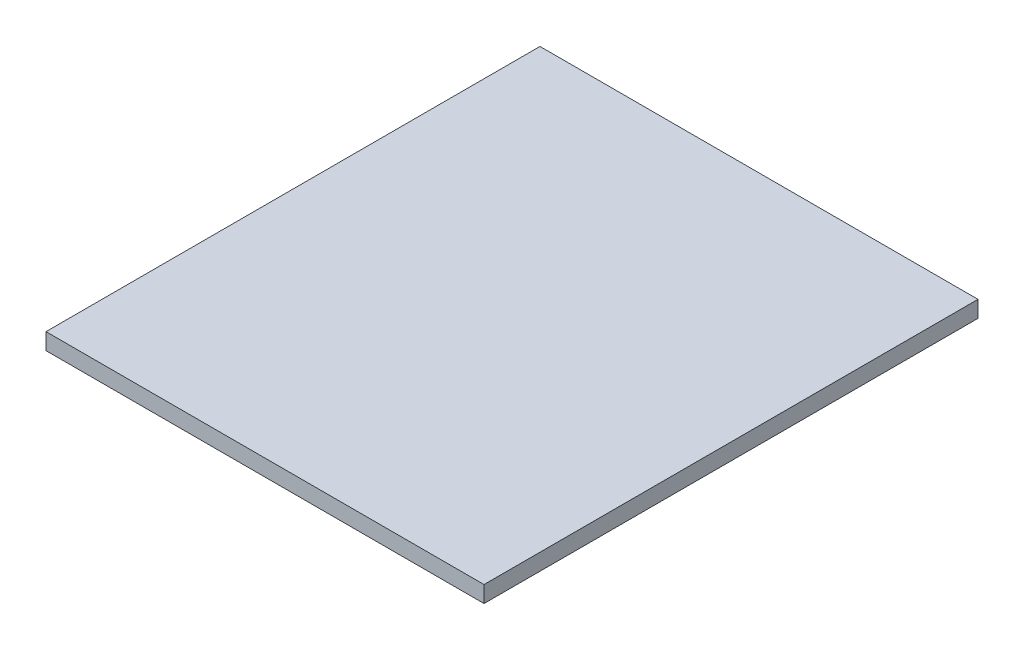
from build123d import *

# Parameters (mm, degrees)
BOSS_EXTRUDE1_DEPTH      = 0.591745503
BOSS_EXTRUDE1_DEPTH_BACK = 2.806010268
SKETCH1_W                = 90.277869284
SKETCH1_H                = 101.808016186


with BuildPart() as part:
    # Sketch1 → Boss-Extrude1 (new, two sides: drawn at the far end of the back side and taken through both)
    with BuildSketch(Plane(origin=(0.597296835, 0, -0.062875246), x_dir=(1, 0, 0), z_dir=(0, 1, 0)).offset(-BOSS_EXTRUDE1_DEPTH_BACK)):
        with Locations((11.749685836, -32.127153015)):
            Rectangle(SKETCH1_W, SKETCH1_H)
    extrude(amount=BOSS_EXTRUDE1_DEPTH + BOSS_EXTRUDE1_DEPTH_BACK)


solid = part.part
